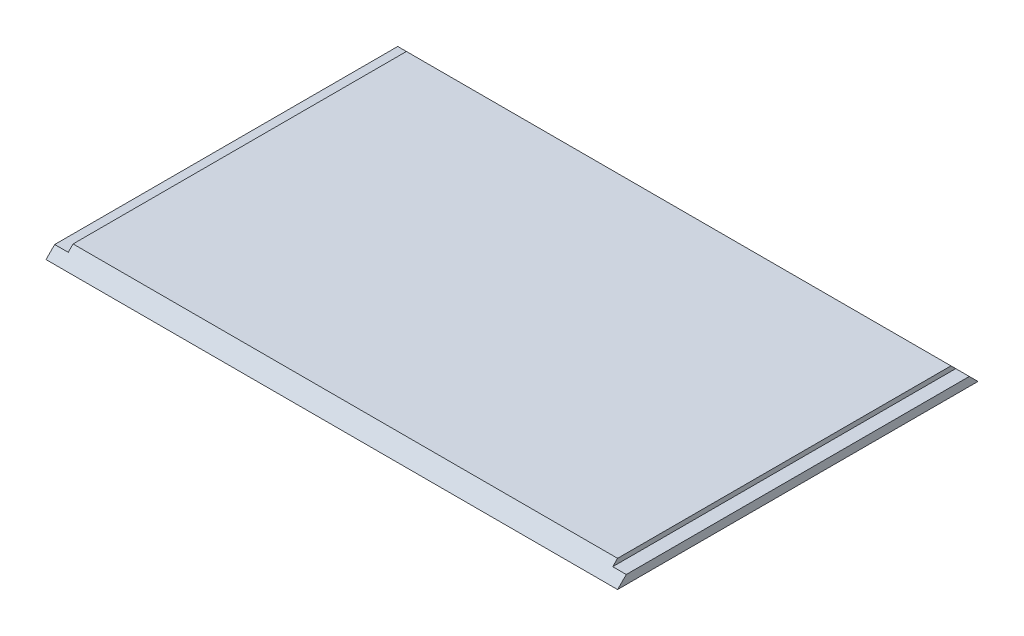
from build123d import *

# Parameters (mm, degrees)
SKETCH_1_W          = 118.3
SKETCH_1_H          = 74.6
EXTRUDE_1_DEPTH     = 2.8
SKETCH_2_W          = 2.8
SKETCH_2_H          = 74.6
CUT_EXTRUDE_1_DEPTH = 1
CUT_EXTRUDE_2_DEPTH = 130.252166362


with BuildPart() as part:
    # 草图1 → 凸台-拉伸1 (new body)
    with BuildSketch(Plane(origin=(0, 0, 0), x_dir=(1, 0, 0), z_dir=(0, 1, 0))):
        with Locations((7.144851485, -14.694158416)):
            Rectangle(SKETCH_1_W, SKETCH_1_H)
    extrude(amount=EXTRUDE_1_DEPTH)

    # 草图2 → 切除-拉伸1 (cut)
    with BuildSketch(Plane(origin=(0, 2.8, 0), x_dir=(1, 0, 0), z_dir=(0, 1, 0))):
        with Locations((64.894851485, -14.694158416)):
            Rectangle(SKETCH_2_W, SKETCH_2_H)
        with Locations((-50.605148515, -14.694158416)):
            Rectangle(SKETCH_2_W, SKETCH_2_H)
    extrude(amount=-CUT_EXTRUDE_1_DEPTH, mode=Mode.SUBTRACT)

    # 草图3 → 切除-拉伸2 (cut, through all)
    with BuildSketch(Plane(origin=(66.294851485, 0, 0), x_dir=(0, 0, -1), z_dir=(1, 0, 0))):
        Polygon((-51.994158416, 0), (-49.194158416, 2.8), (-51.994158416, 2.8), align=None)
        Polygon((22.605841584, 0), (19.805841584, 2.8), (22.605841584, 2.8), align=None)
    extrude(amount=-CUT_EXTRUDE_2_DEPTH, mode=Mode.SUBTRACT)


solid = part.part
